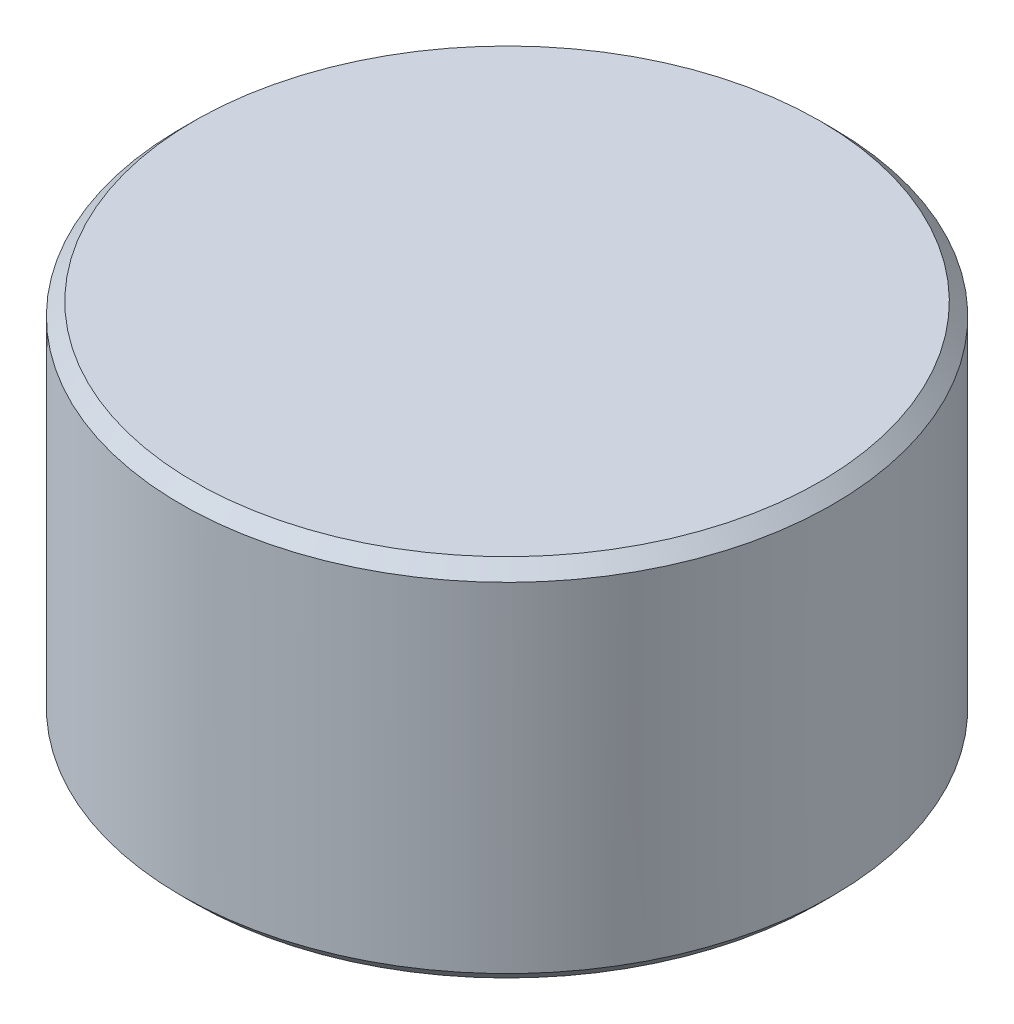
from build123d import *

# Parameters (mm, degrees)
SKETCH1_R           = 2.5
BOSS_EXTRUDE1_DEPTH = 2.8
CHAMFER1_SIZE       = 0.1


with BuildPart() as part:
    # Sketch1 → Boss-Extrude1 (new body)
    with BuildSketch(Plane(origin=(0, 0, 0), x_dir=(1, 0, 0), z_dir=(0, 1, 0))):
        with Locations(Location((0, 0, 0), (0, 0, 270))):
            Circle(SKETCH1_R)
    extrude(amount=BOSS_EXTRUDE1_DEPTH)

    # Chamfer1
    chamfer1_edges = [part.edges().sort_by_distance(p)[0] for p in [
        (0, 0, -2.5),
        (0, 2.8, -2.5),
    ]]
    chamfer(chamfer1_edges, length=CHAMFER1_SIZE)


solid = part.part
